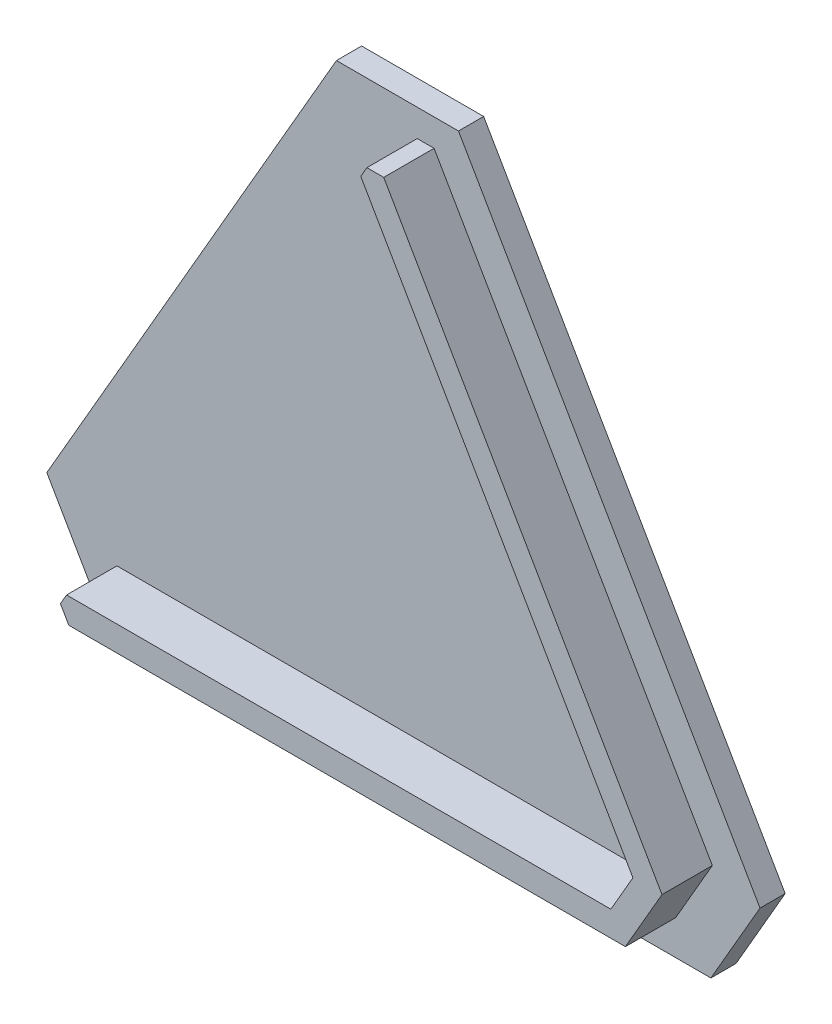
from build123d import *

# Parameters (mm, degrees)
BOSS_EXTRUDE1_DEPTH = 10
BOSS_EXTRUDE2_DEPTH = 5


with BuildPart() as part:
    # Sketch2 → Boss-Extrude1 (new body)
    with BuildSketch(Plane.XY.offset(297.14777646)):
        Polygon((222.115957416, -44.106514518), (277.385017308, -139.835334338), (270.115957416, -152.425715395), (159.577837631, -152.425715395), (157.90907535, -149.535334338), (159.127064415, -147.425715395), (267.22920607, -147.425715395), (271.611514616, -139.835334338), (217.560443789, -46.216133462), (218.778432853, -44.106514518), align=None)
    extrude(amount=-BOSS_EXTRUDE1_DEPTH)

    # Sketch3 → Boss-Extrude2 (add)
    with BuildSketch(Plane.XY.offset(297.14777646)):
        Polygon((202.72809537, -38.706514518), (226.965699677, -38.706514518), (286.851062648, -142.431005814), (277.096897524, -159.325715395), (157.326171581, -159.325715395), (145.207369428, -138.335334338), align=None)
    extrude(amount=BOSS_EXTRUDE2_DEPTH)


with BuildPart() as body_2:
    # Mirror1: mirrored copy
    add(part.part.mirror(Plane(origin=(218.778432853, -44.106514518, 287.14777646), x_dir=(1, 0, 0), z_dir=(0, 0, 1))))


solid = body_2.part
